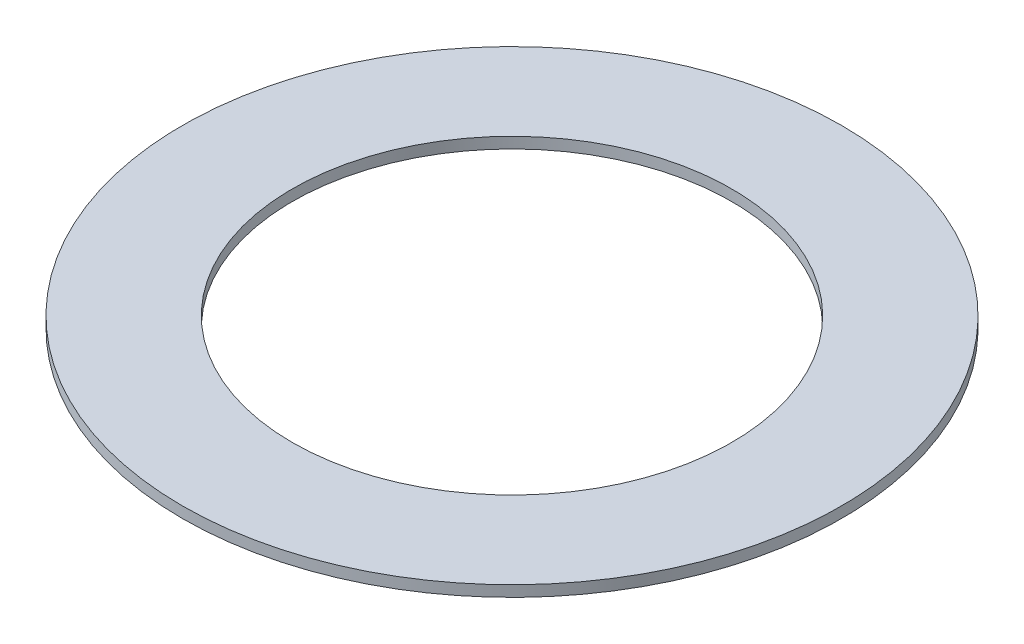
from build123d import *

# Parameters (mm, degrees)
SKETCH1_R           = 30
SKETCH1_R_2         = 20
BOSS_EXTRUDE1_DEPTH = 1


with BuildPart() as part:
    # Sketch1 → Boss-Extrude1 (new body)
    with BuildSketch(Plane(origin=(0, 0, 0), x_dir=(1, 0, 0), z_dir=(0, 1, 0))):
        with Locations(Location((0, 0, 0), (0, 0, 270))):
            Circle(SKETCH1_R)
        with Locations(Location((0, 0, 0), (0, 0, 270))):
            Circle(SKETCH1_R_2, mode=Mode.SUBTRACT)
    extrude(amount=BOSS_EXTRUDE1_DEPTH)


solid = part.part
